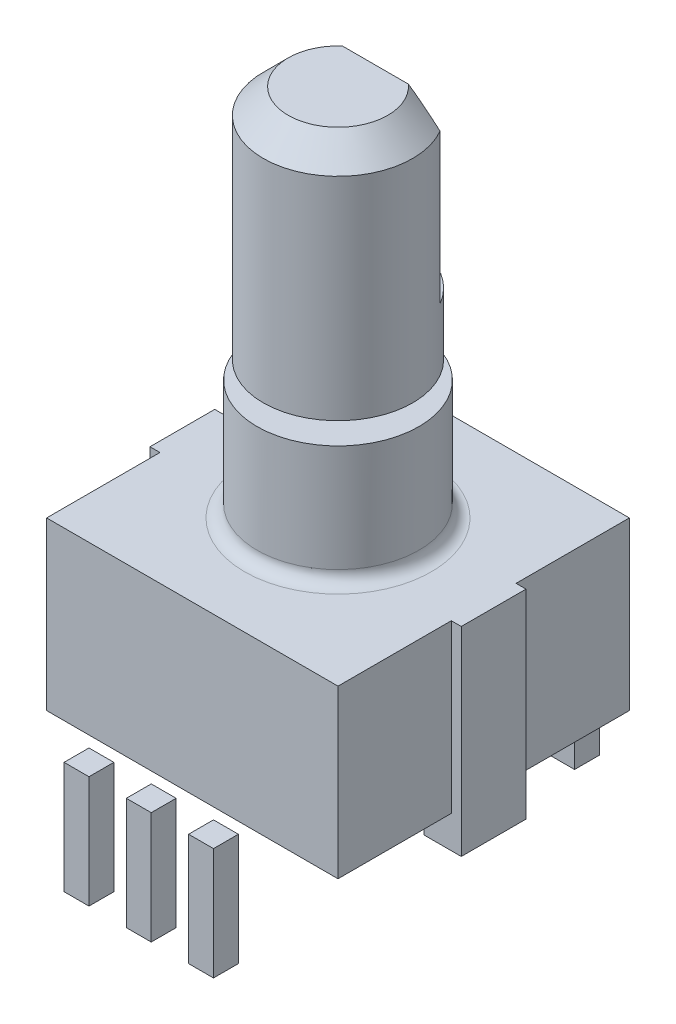
from build123d import *

# Parameters (mm, degrees)
SKETCH1_W             = 11.7
SKETCH1_H             = 11.7
BOSS_EXTRUDE1_DEPTH   = 6.7
SKETCH2_R             = 3.25
BOSS_EXTRUDE2_DEPTH   = 4.8
FILLET1_R             = 0.5
SKETCH3_R             = 2
BOSS_EXTRUDE3_DEPTH   = 0.7
SKETCH4_R             = 3
BOSS_EXTRUDE4_DEPTH   = 9.5
CUT_EXTRUDE1_START    = -7
CUT_EXTRUDE1_DEPTH    = 7
BOSS_EXTRUDE5_START   = -6
SKETCH6_W             = 1
SKETCH6_H             = 1
BOSS_EXTRUDE5_DEPTH   = 4.5
BOSS_EXTRUDE5_2_DEPTH = 4.5
BOSS_EXTRUDE5_3_DEPTH = 4.5
BOSS_EXTRUDE5_4_DEPTH = 4.5
BOSS_EXTRUDE5_5_DEPTH = 4.5
SKETCH8_W             = 1.5
SKETCH8_H             = 2.6
BOSS_EXTRUDE6_DEPTH   = 8
CHAMFER1_SIZE         = 1


with BuildPart() as part:
    # Sketch1 → Boss-Extrude1 (new body)
    with BuildSketch(Plane(origin=(0, 0, 0), x_dir=(1, 0, 0), z_dir=(0, 1, 0))):
        Rectangle(SKETCH1_W, SKETCH1_H)
    extrude(amount=-BOSS_EXTRUDE1_DEPTH)

    # Sketch2 → Boss-Extrude2 (add)
    with BuildSketch(Plane(origin=(0, 0, 0), x_dir=(1, 0, 0), z_dir=(0, 1, 0))):
        with Locations(Location((0, 0, 0), (0, 0, 270))):
            Circle(SKETCH2_R)
    extrude(amount=BOSS_EXTRUDE2_DEPTH)

    # Fillet1
    fillet1_edges = [part.edges().sort_by_distance(p)[0] for p in [
        (0, 0, -3.25),
    ]]
    fillet(fillet1_edges, radius=FILLET1_R)

    # Sketch3 → Boss-Extrude3 (add)
    with BuildSketch(Plane(origin=(0, 4.8, 0), x_dir=(1, 0, 0), z_dir=(0, 1, 0))):
        with Locations(Location((0, 0, 0), (0, 0, 270))):
            Circle(SKETCH3_R)
    extrude(amount=BOSS_EXTRUDE3_DEPTH)

    # Sketch4 → Boss-Extrude4 (add)
    with BuildSketch(Plane(origin=(0, 5.5, 0), x_dir=(1, 0, 0), z_dir=(0, 1, 0))):
        with Locations(Location((0, 0, 0), (0, 0, 270))):
            Circle(SKETCH4_R)
    extrude(amount=BOSS_EXTRUDE4_DEPTH)

    # Sketch5 → Cut-Extrude1 (cut)
    with BuildSketch(Plane(origin=(0, 15, 0), x_dir=(1, 0, 0), z_dir=(0, 1, 0)).offset(CUT_EXTRUDE1_START)):
        with BuildLine():
            Line((-2.598076211, 1.5), (2.598076211, 1.5))
            ThreePointArc((2.598076211, 1.5), (0, 3), (-2.598076211, 1.5))
        make_face()
    extrude(amount=CUT_EXTRUDE1_DEPTH, mode=Mode.SUBTRACT)

    # Sketch8 → Boss-Extrude6 (add)
    with BuildSketch(Plane(origin=(0, 0, 0), x_dir=(1, 0, 0), z_dir=(0, 1, 0))):
        with Locations((-5.5, 0)):
            Rectangle(SKETCH8_W, SKETCH8_H)
        with Locations((5.5, 0)):
            Rectangle(SKETCH8_W, SKETCH8_H)
    extrude(amount=-BOSS_EXTRUDE6_DEPTH)

    # Chamfer1
    chamfer1_edges = [part.edges().sort_by_distance(p)[0] for p in [
        (2.598076211, 15, 1.5),
    ]]
    chamfer(chamfer1_edges, length=CHAMFER1_SIZE)


with BuildPart() as body_2:
    # Sketch6 → Boss-Extrude5 (new body)
    with BuildSketch(Plane(origin=(0, 0, 0), x_dir=(1, 0, 0), z_dir=(0, 1, 0)).offset(BOSS_EXTRUDE5_START)):
        with Locations((-2.5, 7)):
            Rectangle(SKETCH6_W, SKETCH6_H)
    extrude(amount=-BOSS_EXTRUDE5_DEPTH)


with BuildPart() as body_3:
    # Sketch6 → Boss-Extrude5 2 (new body)
    with BuildSketch(Plane(origin=(0, 0, 0), x_dir=(1, 0, 0), z_dir=(0, 1, 0)).offset(BOSS_EXTRUDE5_START)):
        with Locations((2.5, 7)):
            Rectangle(SKETCH6_W, SKETCH6_H)
    extrude(amount=-BOSS_EXTRUDE5_2_DEPTH)


with BuildPart() as body_4:
    # Sketch6 → Boss-Extrude5 3 (new body)
    with BuildSketch(Plane(origin=(0, 0, 0), x_dir=(1, 0, 0), z_dir=(0, 1, 0)).offset(BOSS_EXTRUDE5_START)):
        with Locations((0, -7.5)):
            Rectangle(SKETCH6_W, SKETCH6_H)
    extrude(amount=-BOSS_EXTRUDE5_3_DEPTH)


with BuildPart() as body_5:
    # Sketch6 → Boss-Extrude5 4 (new body)
    with BuildSketch(Plane(origin=(0, 0, 0), x_dir=(1, 0, 0), z_dir=(0, 1, 0)).offset(BOSS_EXTRUDE5_START)):
        with Locations((2.5, -7.5)):
            Rectangle(SKETCH6_W, SKETCH6_H)
    extrude(amount=-BOSS_EXTRUDE5_4_DEPTH)


with BuildPart() as body_6:
    # Sketch6 → Boss-Extrude5 5 (new body)
    with BuildSketch(Plane(origin=(0, 0, 0), x_dir=(1, 0, 0), z_dir=(0, 1, 0)).offset(BOSS_EXTRUDE5_START)):
        with Locations((-2.5, -7.5)):
            Rectangle(SKETCH6_W, SKETCH6_H)
    extrude(amount=-BOSS_EXTRUDE5_5_DEPTH)


solid = Compound([part.part, body_2.part, body_3.part, body_4.part, body_5.part, body_6.part])
